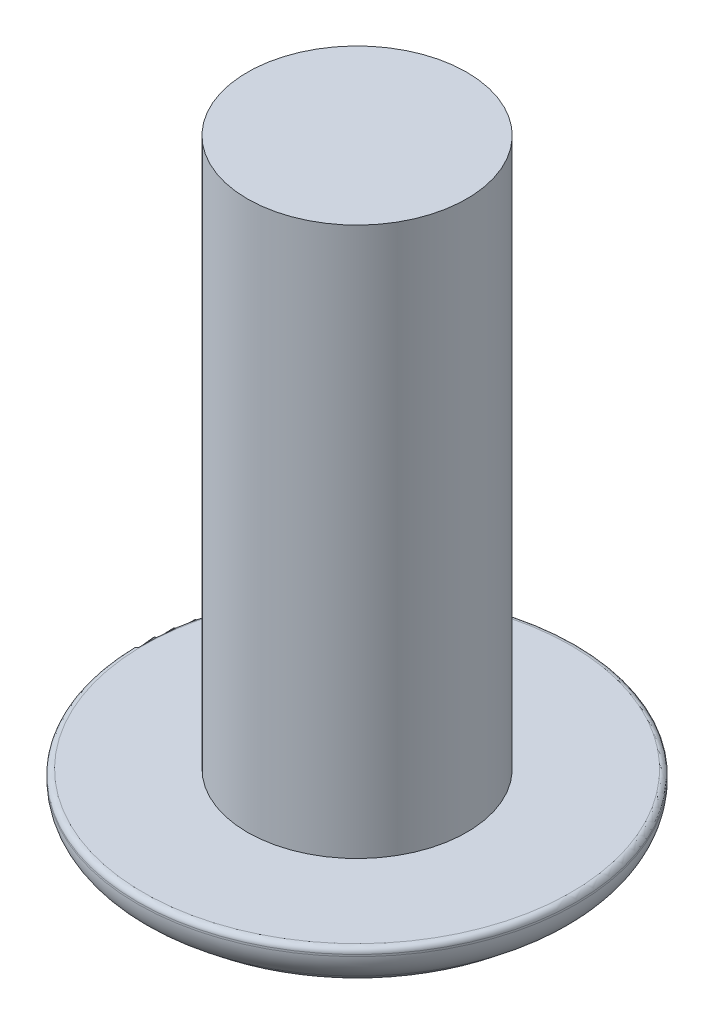
from build123d import *

# Parameters (mm, degrees)
SKETCH2_W = 50
SKETCH2_H = 10
FILLET1_R = 3
FILLET2_R = 0.5


with BuildPart() as part:
    # Sketch2 → Revolve1 (revolve)
    with BuildSketch(Plane.YZ, mode=Mode.PRIVATE) as revolve1_sk:
        with BuildLine():
            Line((-10, 0), (-2, 0))
            Line((-2, 0), (-2, 20))
            ThreePointArc((-2, 20), (-7.925824036, 10.770329614), (-10, 0))
        make_face()
        Polygon((-2, 20), (-2, 0), (0, 0), (0, 10), (0, 20), align=None)
        with Locations((25, 5)):
            Rectangle(SKETCH2_W, SKETCH2_H)
    revolve(revolve1_sk.sketch.rotate(Axis((0, -34.621126621, 0), (0, 1, 0)), 180), axis=Axis((0, -34.621126621, 0), (0, 1, 0)))

    # Fillet1
    fillet1_edges = [part.edges().sort_by_distance(p)[0] for p in [
        (0, -2, 20),
    ]]
    fillet(fillet1_edges, radius=FILLET1_R)

    # Fillet2
    fillet2_edges = [part.edges().sort_by_distance(p)[0] for p in [
        (0, 0, 20),
    ]]
    fillet(fillet2_edges, radius=FILLET2_R)


solid = part.part
